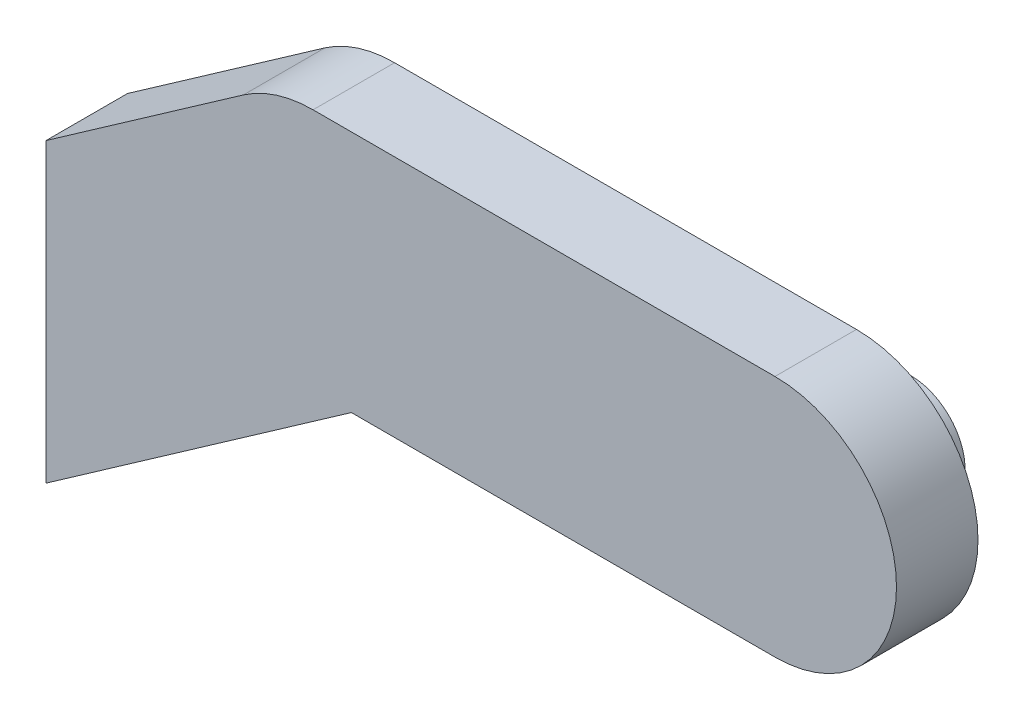
from build123d import *

# Parameters (mm, degrees)
SKETCH_1_W          = 300
SKETCH_1_H          = 44.73
EXTRUDE_1_DEPTH     = 15
CUT_EXTRUDE_4_REACH = 305.687
SKETCH_6_R          = 10
EXTRUDE_2_DEPTH     = 10
SKETCH_7_R          = 1
CUT_EXTRUDE_6_DEPTH = 5
EXTRUDE_START       = 15
EXTRUDE_5_DEPTH     = 15
CUT_EXTRUDE_7_DEPTH = 15


with BuildPart() as part:
    # 草图1 → 凸台-拉伸1 (new body)
    with BuildSketch(Plane.XY):
        with Locations((150, 22.365)):
            Rectangle(SKETCH_1_W, SKETCH_1_H)
    extrude(amount=EXTRUDE_1_DEPTH)

    # 草图4 → 切除-拉伸4 (cut, up to next)
    with BuildSketch(Plane.XY.offset(15), mode=Mode.PRIVATE) as cut_extrude_4_sk1:
        with BuildLine():
            Line((300, 44.73), (153.211623388, 44.73))
            ThreePointArc((153.211623388, 44.73), (175.576623388, 22.365), (153.211623388, 0))
            Line((153.211623388, 0), (300, 0))
            Line((300, 0), (300, 44.73))
        make_face()
    cut_extrude_4_tool1 = extrude(cut_extrude_4_sk1.sketch, amount=-CUT_EXTRUDE_4_REACH, mode=Mode.PRIVATE) & part.part
    add(cut_extrude_4_tool1.solids().sort_by_distance((235.292113, 22.365, 15))[0], mode=Mode.SUBTRACT)

    # 草图6 → 凸台-拉伸2 (add)
    with BuildSketch(Plane(origin=(0, 0, 0), x_dir=(-1, 0, 0), z_dir=(0, 0, -1))):
        with Locations((-153.211623388, 22.365)):
            Circle(SKETCH_6_R)
    extrude(amount=EXTRUDE_2_DEPTH)

    # 草图7 → 切除-拉伸6 (cut)
    with BuildSketch(Plane(origin=(0, 0, -10), x_dir=(-1, 0, 0), z_dir=(0, 0, -1))):
        with Locations((-153.211623388, 29.365)):
            Circle(SKETCH_7_R)
        with Locations((-146.211623388, 22.365)):
            Circle(SKETCH_7_R)
        with Locations((-153.211623388, 15.365)):
            Circle(SKETCH_7_R)
        with Locations((-160.211623388, 22.365)):
            Circle(SKETCH_7_R)
    extrude(amount=-CUT_EXTRUDE_6_DEPTH, mode=Mode.SUBTRACT)

    # 草图9 → 凸台-拉伸5 (add)
    # profile 1 of 8: a face of its own
    with BuildSketch(Plane.XY.offset(EXTRUDE_START)):
        with BuildLine():
            ThreePointArc((49.891287917, 9.536963001), (46.186397992, 26.248641494), (55.383586389, 40.685335471))
            Line((55.383586389, 40.685335471), (19.062500731, 15.253037497))
            Line((19.062500731, 15.253037497), (19.062500731, -12.049586181))
            Line((19.062500731, -12.049586181), (49.891287917, 9.536963001))
        make_face()
    # profile 2 of 8: a face of its own
    with BuildSketch(Plane.XY.offset(EXTRUDE_START)):
        with BuildLine():
            ThreePointArc((68.211623388, 0), (57.884615653, 2.527002716), (49.891287917, 9.536963001))
            Line((49.891287917, 9.536963001), (19.062500731, -12.049586181))
            Line((19.062500731, -12.049586181), (19.062500731, -39.352209859))
            Line((19.062500731, -39.352209859), (75.263280801, 0))
            Line((75.263280801, 0), (68.211623388, 0))
        make_face()
    # profile 3 of 8: a face of its own
    with BuildSketch(Plane.XY.offset(EXTRUDE_START)):
        with BuildLine():
            ThreePointArc((90.576623388, 22.365), (84.026066549, 38.179443161), (68.211623388, 44.73))
            ThreePointArc((68.211623388, 44.73), (61.486338182, 43.694879603), (55.383586389, 40.685335471))
            ThreePointArc((55.383586389, 40.685335471), (46.186397992, 26.248641494), (49.891287917, 9.536963001))
            Line((49.891287917, 9.536963001), (68.211623388, 22.365))
            Line((68.211623388, 22.365), (90.576623388, 22.365))
        make_face()
    # profile 4 of 8: a face of its own
    with BuildSketch(Plane.XY.offset(EXTRUDE_START)):
        with BuildLine():
            ThreePointArc((81.039660387, 4.044664529), (88.049620672, 12.037992265), (90.576623388, 22.365))
            Line((90.576623388, 22.365), (68.211623388, 22.365))
            Line((68.211623388, 22.365), (49.891287917, 9.536963001))
            ThreePointArc((49.891287917, 9.536963001), (57.884615653, 2.527002716), (68.211623388, 0))
            ThreePointArc((68.211623388, 0), (74.936908594, 1.035120397), (81.039660387, 4.044664529))
        make_face()
    # profile 5 of 8: a face of its own
    with BuildSketch(Plane.XY.offset(EXTRUDE_START)):
        with BuildLine():
            ThreePointArc((153.211623388, 0), (137.397180227, 6.550556839), (130.846623388, 22.365))
            Line((130.846623388, 22.365), (90.576623388, 22.365))
            ThreePointArc((90.576623388, 22.365), (88.049620672, 12.037992265), (81.039660387, 4.044664529))
            Line((81.039660387, 4.044664529), (75.263280801, 0))
            Line((75.263280801, 0), (153.211623388, 0))
        make_face()
    # profile 6 of 8: a face of its own
    with BuildSketch(Plane.XY.offset(EXTRUDE_START)):
        with BuildLine():
            ThreePointArc((130.846623388, 22.365), (137.397180227, 38.179443161), (153.211623388, 44.73))
            Line((153.211623388, 44.73), (68.211623388, 44.73))
            ThreePointArc((68.211623388, 44.73), (84.026066549, 38.179443161), (90.576623388, 22.365))
            Line((90.576623388, 22.365), (130.846623388, 22.365))
        make_face()
    # profile 7 of 8: a face of its own
    with BuildSketch(Plane.XY.offset(EXTRUDE_START)):
        with BuildLine():
            ThreePointArc((175.576623388, 22.365), (169.026066549, 38.179443161), (153.211623388, 44.73))
            ThreePointArc((153.211623388, 44.73), (137.397180227, 38.179443161), (130.846623388, 22.365))
            ThreePointArc((130.846623388, 22.365), (137.397180227, 6.550556839), (153.211623388, 0))
            ThreePointArc((153.211623388, 0), (169.026066549, 6.550556839), (175.576623388, 22.365))
        make_face()
        with BuildLine():
            ThreePointArc((163.211623388, 22.365), (153.211623388, 12.365), (143.211623388, 22.365))
            ThreePointArc((143.211623388, 22.365), (153.211623388, 32.365), (163.211623388, 22.365))
        make_face(mode=Mode.SUBTRACT)
    # profile 8 of 8: a face of its own
    with BuildSketch(Plane.XY.offset(EXTRUDE_START)):
        with BuildLine():
            Line((75.263280801, 0), (81.039660387, 4.044664529))
            ThreePointArc((81.039660387, 4.044664529), (74.936908594, 1.035120397), (68.211623388, 0))
            Line((68.211623388, 0), (75.263280801, 0))
        make_face()
    extrude(amount=-EXTRUDE_5_DEPTH)

    # 草图10 → 切除-拉伸7 (cut)
    with BuildSketch(Plane(origin=(0, 0, 0), x_dir=(-1, 0, 0), z_dir=(0, 0, -1))):
        with BuildLine():
            Line((-19.062500731, 15.253037497), (-19.062500731, 0))
            Line((-19.062500731, 0), (0, 0))
            Line((0, 0), (0, 44.73))
            Line((0, 44.73), (-68.211623388, 44.73))
            ThreePointArc((-68.211623388, 44.73), (-61.486338182, 43.694879603), (-55.383586389, 40.685335471))
            Line((-55.383586389, 40.685335471), (-19.062500731, 15.253037497))
        make_face()
    extrude(amount=-CUT_EXTRUDE_7_DEPTH, mode=Mode.SUBTRACT)


solid = part.part
